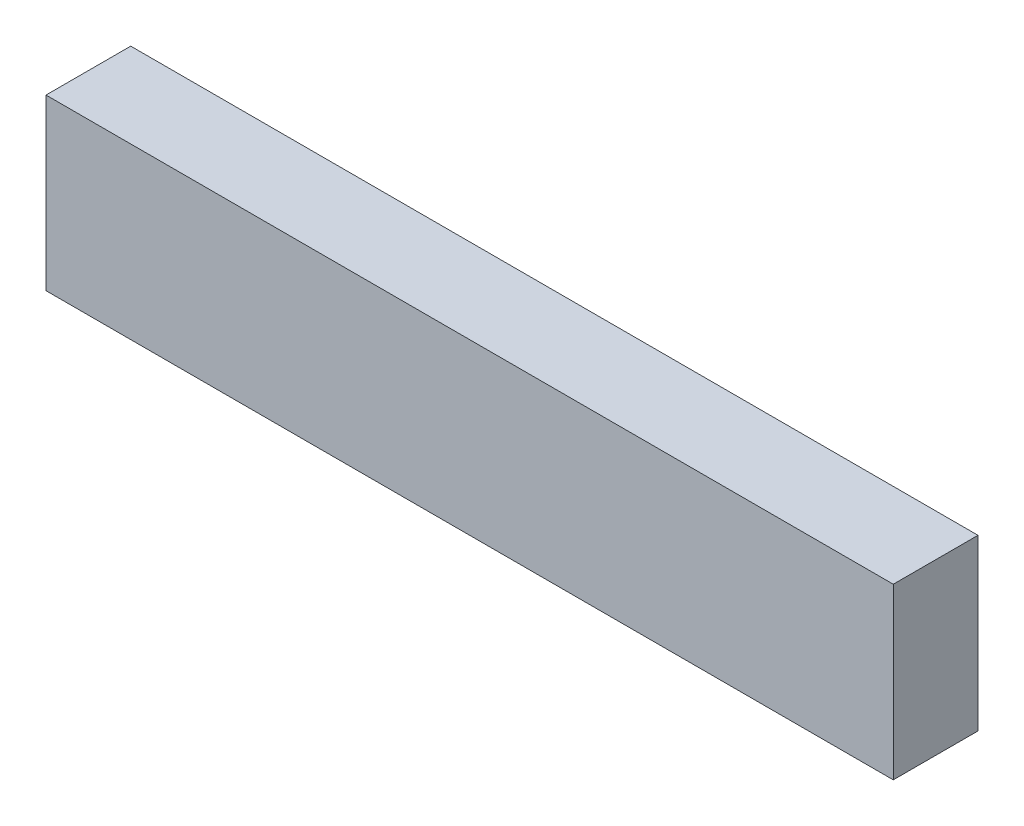
from build123d import *

# Parameters (mm, degrees)
SKETCH2_W           = 100
SKETCH2_H           = 10
BOSS_EXTRUDE2_DEPTH = 10


with BuildPart() as part:
    # Sketch2 → Boss-Extrude2 (new, symmetric)
    with BuildSketch(Plane(origin=(0, 0, 0), x_dir=(1, 0, 0), z_dir=(0, 1, 0))):
        Rectangle(SKETCH2_W, SKETCH2_H)
    extrude(amount=BOSS_EXTRUDE2_DEPTH, both=True)


solid = part.part
